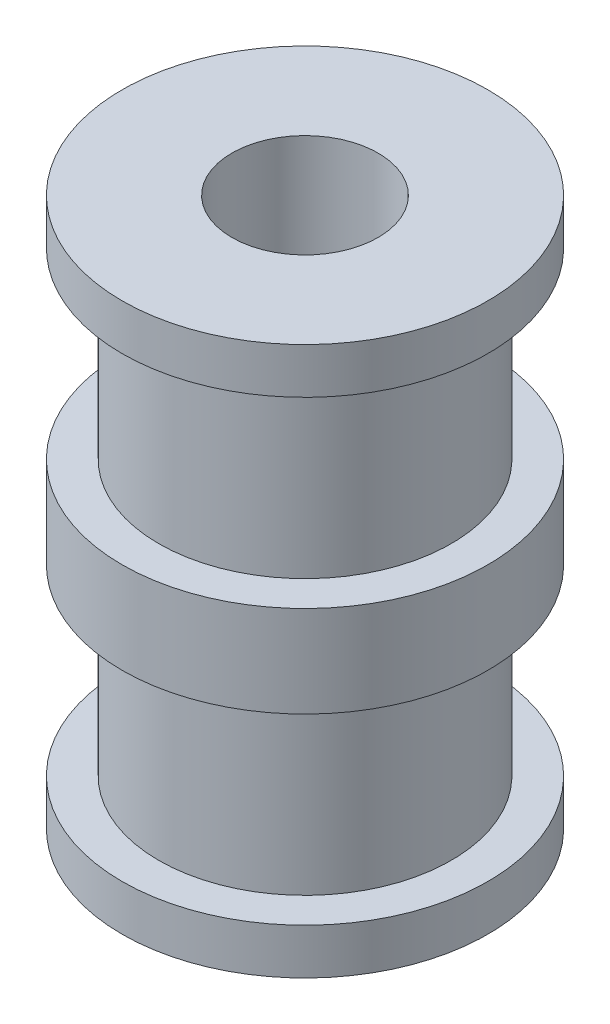
from build123d import *

# Parameters (mm, degrees)
ESQUISSE1_R        = 4
ESQUISSE1_R_2      = 2
BOSS_EXTRU_1_DEPTH = 15
ESQUISSE2_R        = 5
ESQUISSE2_R_2      = 2
BOSS_EXTRU_2_DEPTH = 1.25
ESQUISSE3_R        = 5
ESQUISSE3_R_2      = 2
BOSS_EXTRU_3_DEPTH = 2.5
BOSS_EXTRU_5_START = -1.25
ESQUISSE5_R        = 5
ESQUISSE5_R_2      = 2
BOSS_EXTRU_5_DEPTH = 1.25


with BuildPart() as part:
    # Esquisse1 → Boss.-Extru.1 (new body)
    with BuildSketch(Plane(origin=(0, 0, 0), x_dir=(1, 0, 0), z_dir=(0, 1, 0))):
        with Locations(Location((0, 0, 0), (0, 0, 270))):
            Circle(ESQUISSE1_R)
        with Locations(Location((0, 0, 0), (0, 0, 270))):
            Circle(ESQUISSE1_R_2, mode=Mode.SUBTRACT)
    extrude(amount=BOSS_EXTRU_1_DEPTH)

    # Esquisse2 → Boss.-Extru.2 (add)
    with BuildSketch(Plane(origin=(0, 0, 0), x_dir=(1, 0, 0), z_dir=(0, 1, 0))):
        with Locations(Location((0, 0, 0), (0, 0, 270))):
            Circle(ESQUISSE2_R)
        with Locations(Location((0, 0, 0), (0, 0, 270))):
            Circle(ESQUISSE2_R_2, mode=Mode.SUBTRACT)
    extrude(amount=BOSS_EXTRU_2_DEPTH)

    # Esquisse3 → Boss.-Extru.3 (add)
    with BuildSketch(Plane(origin=(0, 6.25, 0), x_dir=(1, 0, 0), z_dir=(0, 1, 0))):
        with Locations(Location((0, 0, 0), (0, 0, 270))):
            Circle(ESQUISSE3_R)
        with Locations(Location((0, 0, 0), (0, 0, 270))):
            Circle(ESQUISSE3_R_2, mode=Mode.SUBTRACT)
    extrude(amount=BOSS_EXTRU_3_DEPTH)

    # Esquisse5 → Boss.-Extru.5 (add)
    with BuildSketch(Plane(origin=(0, 15, 0), x_dir=(1, 0, 0), z_dir=(0, 1, 0)).offset(BOSS_EXTRU_5_START)):
        with Locations(Location((0, 0, 0), (0, 0, 270))):
            Circle(ESQUISSE5_R)
        with Locations(Location((0, 0, 0), (0, 0, 270))):
            Circle(ESQUISSE5_R_2, mode=Mode.SUBTRACT)
    extrude(amount=BOSS_EXTRU_5_DEPTH)


solid = part.part
